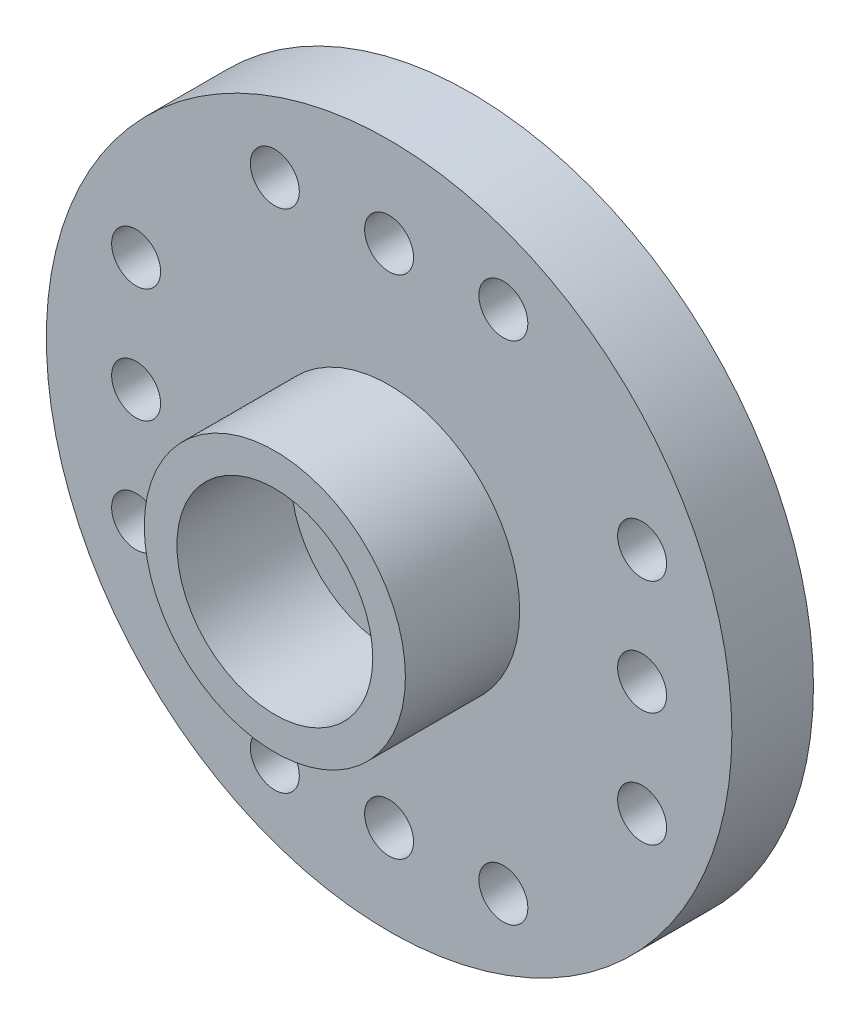
from build123d import *

# Parameters (mm, degrees)
CROQUIS1_R              = 10.5
CROQUIS1_R_2            = 1.5
SALIENTE_EXTRUIR1_DEPTH = 2.5
CROQUIS2_R              = 4
CROQUIS2_R_2            = 3
SALIENTE_EXTRUIR2_DEPTH = 3.5
CROQUIS3_R              = 0.75
CORTAR_EXTRUIR1_DEPTH   = 3.5


with BuildPart() as part:
    # Croquis1 → Saliente-Extruir1 (new body)
    with BuildSketch(Plane.XY):
        Circle(CROQUIS1_R)
        Circle(CROQUIS1_R_2, mode=Mode.SUBTRACT)
    extrude(amount=SALIENTE_EXTRUIR1_DEPTH)

    # Croquis2 → Saliente-Extruir2 (add)
    with BuildSketch(Plane.XY.offset(2.5)):
        Circle(CROQUIS2_R)
        Circle(CROQUIS2_R_2, mode=Mode.SUBTRACT)
    extrude(amount=SALIENTE_EXTRUIR2_DEPTH)

    # Croquis3 → Cortar-Extruir1 (cut)
    with BuildSketch(Plane.XY.offset(2.5)):
        with Locations((-7.75, 0)):
            Circle(CROQUIS3_R)
        with Locations((-7.75, 3.5)):
            Circle(CROQUIS3_R)
        with Locations((-7.75, -3.5)):
            Circle(CROQUIS3_R)
        with Locations((3.5, 7.75)):
            Circle(CROQUIS3_R)
        with Locations((0, 7.75)):
            Circle(CROQUIS3_R)
        with Locations((-3.5, 7.75)):
            Circle(CROQUIS3_R)
        with Locations((7.75, -3.5)):
            Circle(CROQUIS3_R)
        with Locations((7.75, 0)):
            Circle(CROQUIS3_R)
        with Locations((7.75, 3.5)):
            Circle(CROQUIS3_R)
        with Locations((-3.5, -7.75)):
            Circle(CROQUIS3_R)
        with Locations((0, -7.75)):
            Circle(CROQUIS3_R)
        with Locations((3.5, -7.75)):
            Circle(CROQUIS3_R)
    extrude(amount=-CORTAR_EXTRUIR1_DEPTH, mode=Mode.SUBTRACT)


solid = part.part
